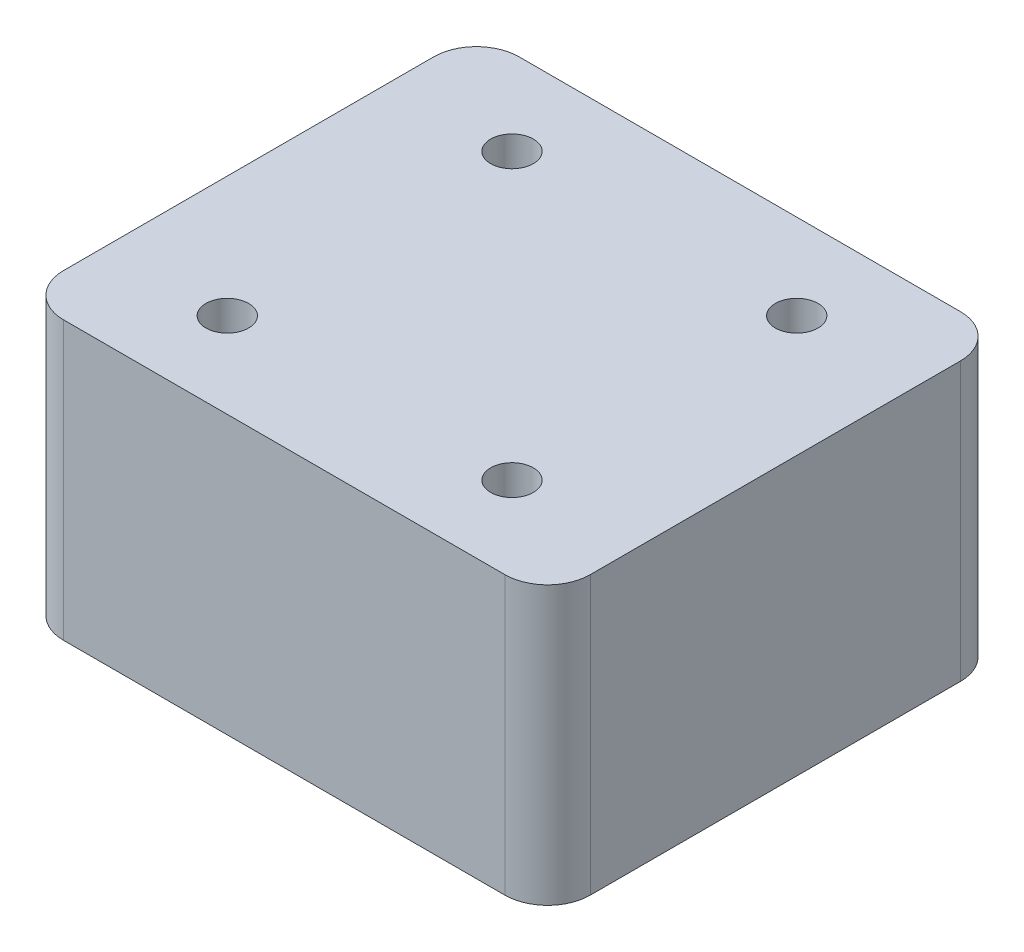
from build123d import *

# Parameters (mm, degrees)
SKETCH1_W           = 37
SKETCH1_H           = 32
BOSS_EXTRUDE1_DEPTH = 19.5
SKETCH1_3_R         = 1.5
CUT_EXTRUDE1_DEPTH  = 10
FILLET1_R           = 3


with BuildPart() as part:
    # Sketch1 → Boss-Extrude1 (new body)
    with BuildSketch(Plane(origin=(0, 0, 0), x_dir=(1, 0, 0), z_dir=(0, 1, 0))):
        Rectangle(SKETCH1_W, SKETCH1_H)
    extrude(amount=-BOSS_EXTRUDE1_DEPTH)

    # Sketch1<3> → Cut-Extrude1 (cut)
    with BuildSketch(Plane(origin=(0, 0, 0), x_dir=(1, 0, 0), z_dir=(0, 1, 0))):
        with Locations((-10, 10)):
            Circle(SKETCH1_3_R)
        with Locations((10, 10)):
            Circle(SKETCH1_3_R)
        with Locations((10, -10)):
            Circle(SKETCH1_3_R)
        with Locations((-10, -10)):
            Circle(SKETCH1_3_R)
    extrude(amount=-CUT_EXTRUDE1_DEPTH, mode=Mode.SUBTRACT)

    # Fillet1
    fillet1_edges = [part.edges().sort_by_distance(p)[0] for p in [
        (-18.5, -9.75, -16),
        (18.5, -9.75, -16),
        (18.5, -9.75, 16),
        (-18.5, -9.75, 16),
    ]]
    fillet(fillet1_edges, radius=FILLET1_R)


solid = part.part
